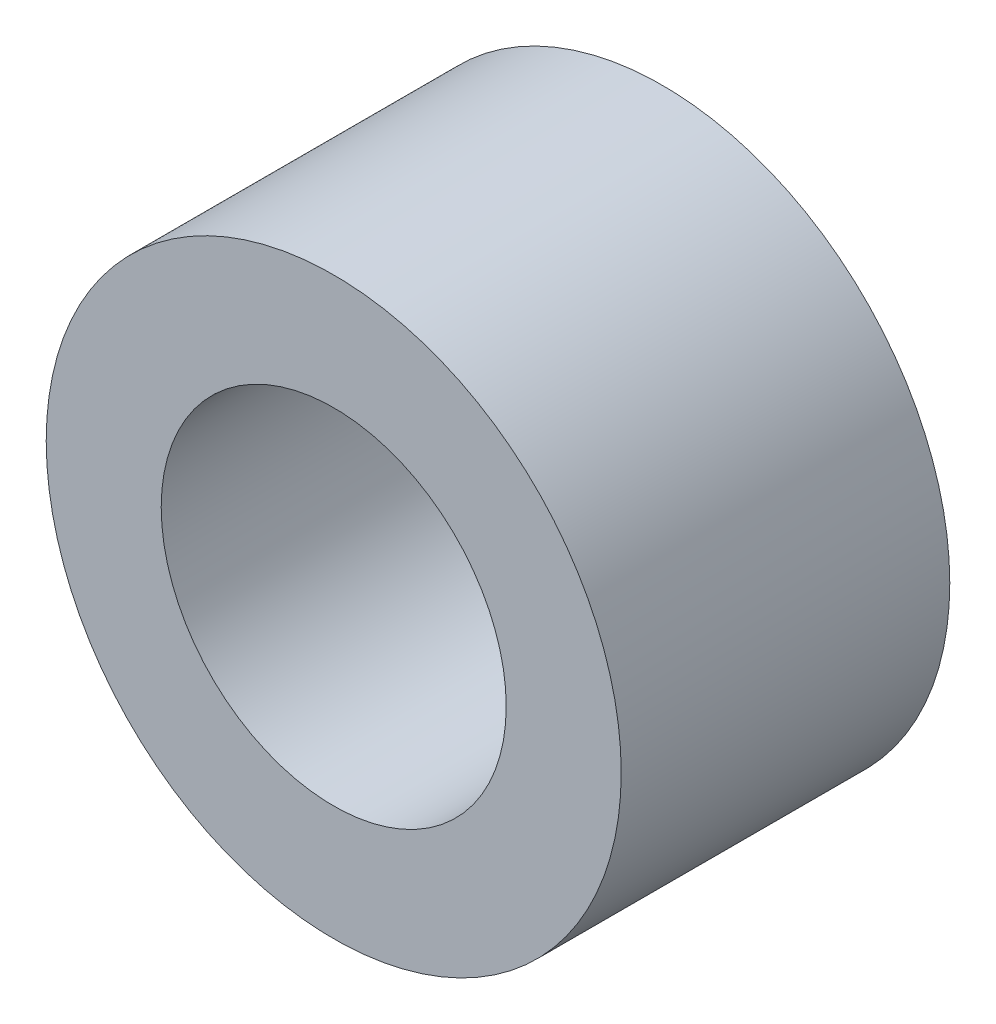
from build123d import *

# Parameters (mm, degrees)
SKETCH_1_R      = 3.5
SKETCH_1_R_2    = 2.1
EXTRUDE_1_DEPTH = 4


with BuildPart() as part:
    # 草图1 → 凸台-拉伸1 (new body)
    with BuildSketch(Plane.XY):
        Circle(SKETCH_1_R)
        Circle(SKETCH_1_R_2, mode=Mode.SUBTRACT)
    extrude(amount=EXTRUDE_1_DEPTH)


solid = part.part
